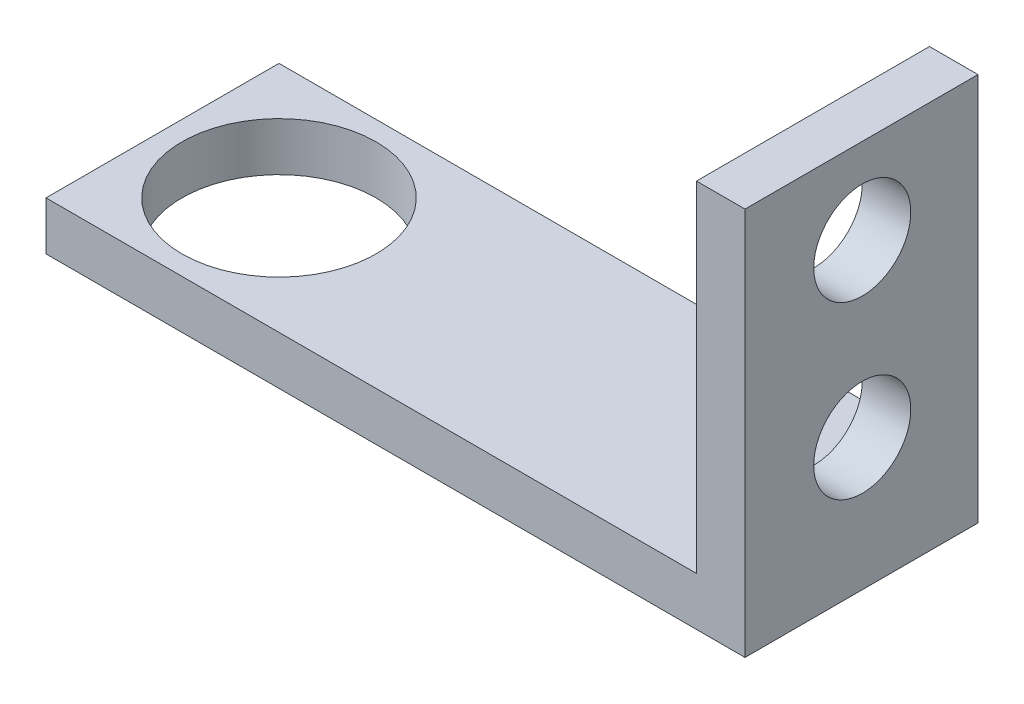
from build123d import *

# Parameters (mm, degrees)
SKETCH1_W                    = 23.8125
SKETCH1_H                    = 7.62
BOSS_EXTRUDE1_DEPTH          = 1.5875
SKETCH1_4_W                  = 1.5875
SKETCH1_4_H                  = 7.62
BOSS_EXTRUDE2_DEPTH          = 12.7
F_1_4_0_25_DIAMETER_HOLE1_D  = 6.35
CUT_EXTRUDE2_DEPTH           = 29.752600861
CUT_EXTRUDE2_DEPTH_BACK      = 1.5875
F_1_8_0_125_DIAMETER_HOLE1_D = 3.175


with BuildPart() as part:
    # Sketch1 → Boss-Extrude1 (new body)
    with BuildSketch(Plane(origin=(0, 0, 0), x_dir=(1, 0, 0), z_dir=(0, 1, 0))):
        with Locations((-13.49375, 3.81)):
            Rectangle(SKETCH1_W, SKETCH1_H)
    extrude(amount=BOSS_EXTRUDE1_DEPTH)

    # Sketch1<4> → Boss-Extrude2 (add)
    with BuildSketch(Plane(origin=(0, 0, 0), x_dir=(1, 0, 0), z_dir=(0, 1, 0))):
        with Locations((-0.79375, 3.81)):
            Rectangle(SKETCH1_4_W, SKETCH1_4_H)
    extrude(amount=BOSS_EXTRUDE2_DEPTH)

    # 1/4 (0.25) Diameter Hole1 (through all)
    with Locations(Plane(origin=(0, 0, 0), x_dir=(-1, 0, 0), z_dir=(0, -1, 0))):
        with Locations((19.05, 3.81)):
            Hole(F_1_4_0_25_DIAMETER_HOLE1_D / 2)

    # Sketch7 → Cut-Extrude2 (cut, two sides: drawn at the far end of the back side and taken through both)
    with BuildSketch(Plane(origin=(0, 1.5875, 0), x_dir=(1, 0, 0), z_dir=(0, 1, 0)).offset(-CUT_EXTRUDE2_DEPTH_BACK)):
        Polygon((-22.86, 65.813111541), (-22.86, 7.62), (-22.86, 0), (-22.86, -58.193111541), (-139.246223082, -58.193111541), (-139.246223082, 65.813111541), align=None)
    extrude(amount=CUT_EXTRUDE2_DEPTH + CUT_EXTRUDE2_DEPTH_BACK, mode=Mode.SUBTRACT)

    # 1/8 (0.125) Diameter Hole1 (through all)
    with Locations(Plane.ZY.offset(1.5875)):
        with Locations((-3.834673101, 9.906), (-3.834673101, 4.318)):
            Hole(F_1_8_0_125_DIAMETER_HOLE1_D / 2)


solid = part.part
